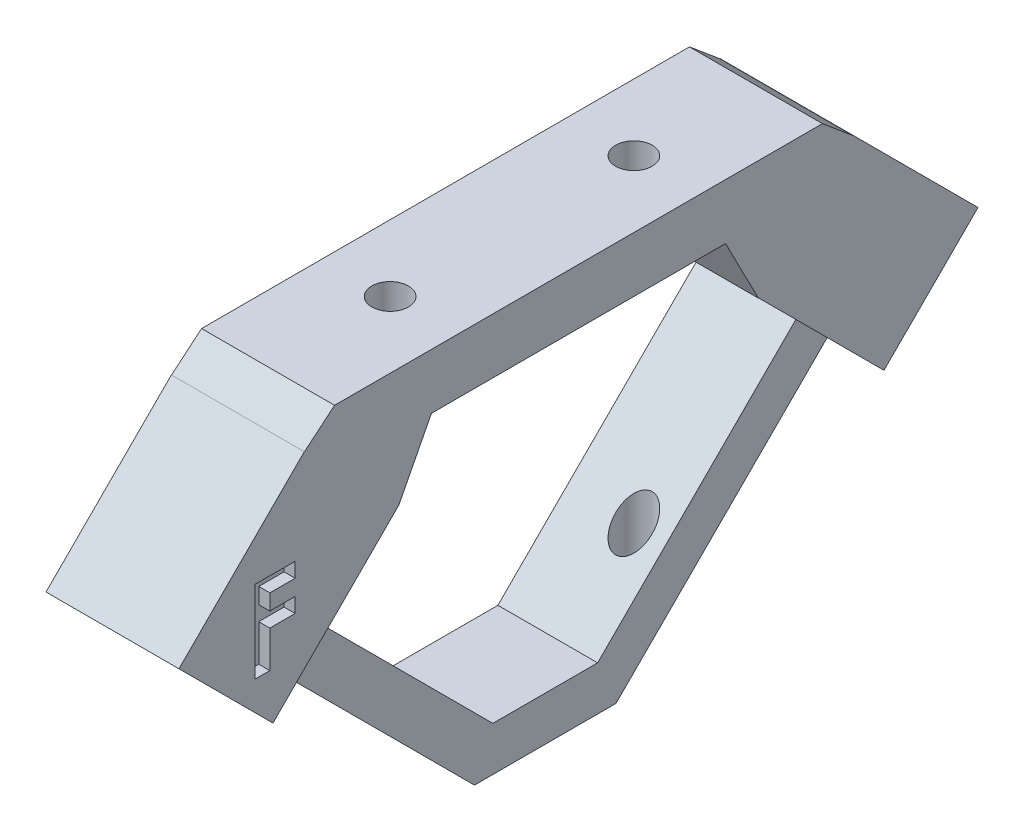
from build123d import *

# Parameters (mm, degrees)
SZKIC2_R                         = 1.65
DODANIE_WYCI_GNI_CIE1_DEPTH      = 3
DODANIE_WYCI_GNI_CIE2_DEPTH      = 5
DODANIE_WYCI_GNI_CIE3_REACH      = 30.62
DODANIE_WYCI_GNI_CIE3_START      = -1
SZKIC7_R                         = 5
SZKIC9_W                         = 12
SZKIC9_H                         = 12
DODANIE_WYCI_GNI_CIE4_DEPTH      = 16
SZKIC10_R                        = 4.1
WYTNIJ_WYCI_GNI_CIE1_DEPTH       = 18
SZKIC12_R                        = 37.17284924
WYTNIJ_WYCI_GNI_CIE2_DEPTH       = 43.690783477
SZKIC13_R                        = 3
WYTNIJ_WYCI_GNI_CIE3_DEPTH       = 42.220824259
SZKIC14_R                        = 1.65
WYTNIJ_WYCI_GNI_CIE4_DEPTH       = 42.220824259
DODANIE_WYCI_GNI_CIE5_DEPTH      = 3
DODANIE_WYCI_GNI_CIE5_DEPTH_BACK = 6
DODANIE_WYCI_GNI_CIE6_REACH      = 55.451
SZKIC16_W                        = 12
SZKIC16_H                        = 5.223766812
SZKIC17_R                        = 1.65
WYTNIJ_WYCI_GNI_CIE5_DEPTH       = 54.450515696
WYTNIJ_WYCI_GNI_CIE6_DEPTH       = 1


with BuildPart() as part:
    # Szkic2 → Dodanie-wyciągnięcie1 (new body)
    with BuildSketch(Plane(origin=(0, 0, 0), x_dir=(1, 0, 0), z_dir=(0, 1, 0))):
        with BuildLine():
            Line((4, 11), (4, -11))
            ThreePointArc((4, -11), (0, -15), (-4, -11))
            Line((-4, -11), (-4, 11))
            ThreePointArc((-4, 11), (0, 15), (4, 11))
        make_face()
        with Locations(Location((0, -11, 0), (0, 0, 270))):
            Circle(SZKIC2_R, mode=Mode.SUBTRACT)
        with Locations(Location((0, 11, 0), (0, 0, 270))):
            Circle(SZKIC2_R, mode=Mode.SUBTRACT)
    extrude(amount=DODANIE_WYCI_GNI_CIE1_DEPTH)

    # Szkic3 → Dodanie-wyciągnięcie2 (add)
    with BuildSketch(Plane(origin=(0, 3, 0), x_dir=(1, 0, 0), z_dir=(0, 1, 0))):
        Polygon((6, 16), (6, -14), (6, -20), (-6, -20), (-6, -14), (-6, 16), (-6, 22), (6, 22), align=None)
        with BuildLine():
            Line((3, 11), (3, -11))
            ThreePointArc((3, -11), (0, -14), (-3, -11))
            Line((-3, -11), (-3, 11))
            ThreePointArc((-3, 11), (0, 14), (3, 11))
        make_face(mode=Mode.SUBTRACT)
    extrude(amount=-DODANIE_WYCI_GNI_CIE2_DEPTH)

    # Dodanie-wyciągnięcie3: up to this face of the body (flat: up to its plane)
    dodanie_wyci_gni_cie3_end = Plane(part.part.faces().sort_by_distance((0, 0, 0))[0])
    # Szkic7 → Dodanie-wyciągnięcie3 (add, up to the picked face)
    with BuildSketch(Plane(origin=(0, -7.995190528, -4.616025404), x_dir=(1, 0, 0), z_dir=(0, -0.866025403784438, -0.500000000000001)).offset(DODANIE_WYCI_GNI_CIE3_START), mode=Mode.PRIVATE) as dodanie_wyci_gni_cie3_sk1:
        with Locations((0, -15.5)):
            Circle(SZKIC7_R)
    dodanie_wyci_gni_cie3_tool1 = split(extrude(dodanie_wyci_gni_cie3_sk1.sketch, amount=-DODANIE_WYCI_GNI_CIE3_REACH, mode=Mode.PRIVATE), bisect_by=dodanie_wyci_gni_cie3_end, keep=Keep.BOTH, mode=Mode.PRIVATE)
    dodanie_wyci_gni_cie3 = dodanie_wyci_gni_cie3_tool1.solids().sort_by(Axis((0, 0.620835, -17.539419), (0, 0.866025403784438, 0.500000000000001)))[0]
    add(dodanie_wyci_gni_cie3)

    # Szkic8 → Wyciągnięcie po profilach1 section 0
    with BuildSketch(Plane(origin=(0, -7.129165125, -4.116025404), x_dir=(-1, 0, 0), z_dir=(0, 0.8660254037844382, 0.5000000000000011))):
        with BuildLine():
            Line((-6, -20.5), (-6, -10.5))
            Line((-6, -10.5), (6, -10.5))
            Line((6, -10.5), (6, -20.5))
            Line((6, -20.5), (-6, -20.5))
        make_face()
    # Szkic5 → Wyciągnięcie po profilach1 section 1
    with BuildSketch(Plane(origin=(0, -12, -12), x_dir=(1, 0, 0), z_dir=(0, 0.7071067811865464, 0.7071067811865488))):
        with BuildLine():
            Line((-6, 18), (-6, 6))
            Line((-6, 6), (6, 6))
            Line((6, 6), (6, 18))
            Line((6, 18), (-6, 18))
        make_face()
    wyci_gni_cie_po_profilach1 = loft()

    # Szkic9 → Dodanie-wyciągnięcie4 (add)
    with BuildSketch(Plane(origin=(0, -12, -12), x_dir=(1, 0, 0), z_dir=(0, -0.7071067811865465, -0.7071067811865487))):
        with Locations((0, -12.018801083)):
            Rectangle(SZKIC9_W, SZKIC9_H)
    dodanie_wyci_gni_cie4 = extrude(amount=DODANIE_WYCI_GNI_CIE4_DEPTH)

    # Szkic10 → Wytnij-wyciągnięcie1 (cut)
    with BuildSketch(Plane(origin=(0, -23.313708499, -23.313708499), x_dir=(1, 0, 0), z_dir=(0, -0.7071067811865465, -0.7071067811865486))):
        with Locations(Location((0, -12, 0), (0, 0, 270))):
            Circle(SZKIC10_R)
    wytnij_wyci_gni_cie1 = extrude(amount=-WYTNIJ_WYCI_GNI_CIE1_DEPTH, mode=Mode.SUBTRACT)

    # Szkic12 → Wytnij-wyciągnięcie2 (cut, through all)
    with BuildSketch(Plane(origin=(0, 3, 0), x_dir=(1, 0, 0), z_dir=(0, 1, 0))):
        Circle(SZKIC12_R)
    wytnij_wyci_gni_cie2 = extrude(amount=WYTNIJ_WYCI_GNI_CIE2_DEPTH, mode=Mode.SUBTRACT)

    # Szkic13 → Wytnij-wyciągnięcie3 (cut, through all)
    with BuildSketch(Plane.XZ):
        with Locations((0, -11)):
            Circle(SZKIC13_R)
    wytnij_wyci_gni_cie3 = extrude(amount=WYTNIJ_WYCI_GNI_CIE3_DEPTH, mode=Mode.SUBTRACT)

    # Lustro1: Dodanie-wyciągnięcie3, Wyciągnięcie po profilach1, Dodanie-wyciągnięcie4, Wytnij-wyciągnięcie1, Wytnij-wyciągnięcie2, Wytnij-wyciągnięcie3 across plane
    add(dodanie_wyci_gni_cie3.mirror(Plane.XY))
    add(wyci_gni_cie_po_profilach1.mirror(Plane.XY))
    add(dodanie_wyci_gni_cie4.mirror(Plane.XY))
    add(wytnij_wyci_gni_cie1.mirror(Plane.XY), mode=Mode.SUBTRACT)
    add(wytnij_wyci_gni_cie2.mirror(Plane.XY), mode=Mode.SUBTRACT)
    add(wytnij_wyci_gni_cie3.mirror(Plane.XY), mode=Mode.SUBTRACT)

    # Szkic14 → Wytnij-wyciągnięcie4 (cut, through all)
    with BuildSketch(Plane.XZ):
        with Locations(Location((0, 11, 0), (0, 0, 90))):
            Circle(SZKIC14_R)
    extrude(amount=-WYTNIJ_WYCI_GNI_CIE4_DEPTH, mode=Mode.SUBTRACT)

    # Szkic15 → Dodanie-wyciągnięcie5 (add, two sides: drawn at the far end of the back side and taken through both)
    with BuildSketch(Plane(origin=(0, 0, 0), x_dir=(0, 0, -1), z_dir=(1, 0, 0)).offset(-DODANIE_WYCI_GNI_CIE5_DEPTH_BACK)):
        Polygon((-25.448323216, -16.936453095), (-6.384776311, -36), (6.384776311, -36), (25.448323216, -16.936453095), (22.619896091, -14.10802597), (4.727922061, -32), (-4.727922061, -32), (-22.619896091, -14.10802597), align=None)
    extrude(amount=DODANIE_WYCI_GNI_CIE5_DEPTH + DODANIE_WYCI_GNI_CIE5_DEPTH_BACK)

    # Szkic16 → Dodanie-wyciągnięcie6 (add, up to next)
    with BuildSketch(Plane(origin=(0, 3, 0), x_dir=(1, 0, 0), z_dir=(0, 1, 0)), mode=Mode.PRIVATE) as dodanie_wyci_gni_cie6_sk1:
        with Locations((0, -19.402002131)):
            Rectangle(SZKIC16_W, SZKIC16_H)
    dodanie_wyci_gni_cie6_tool1 = extrude(dodanie_wyci_gni_cie6_sk1.sketch, amount=-DODANIE_WYCI_GNI_CIE6_REACH, mode=Mode.PRIVATE) - part.part
    add(dodanie_wyci_gni_cie6_tool1.solids().sort_by_distance((0, 3, 19.402002))[0])

    # Szkic17 → Wytnij-wyciągnięcie5 (cut, through all)
    with BuildSketch(Plane(origin=(0, 3, 0), x_dir=(1, 0, 0), z_dir=(0, 1, 0))):
        with Locations(Location((0, 11, 0), (0, 0, 270))):
            Circle(SZKIC17_R)
        with Locations(Location((0, -11, 0), (0, 0, 270))):
            Circle(SZKIC17_R)
    extrude(amount=-WYTNIJ_WYCI_GNI_CIE5_DEPTH, mode=Mode.SUBTRACT)

    # Szkic18 → Wytnij-wyciągnięcie6 (cut)
    with BuildSketch(Plane.ZY.offset(-6)):
        Polygon((29.184280312, -7.406799418), (25.575092277, -7.406799418), (25.575092277, -8.736500273), (27.854579457, -8.736500273), (27.854579457, -10.16117976), (25.575092277, -10.16117976), (25.575092277, -11.490880615), (27.854579457, -11.490880615), (27.854579457, -14.815132751), (29.184280312, -14.815132751), align=None)
    extrude(amount=WYTNIJ_WYCI_GNI_CIE6_DEPTH, mode=Mode.SUBTRACT)


solid = part.part
